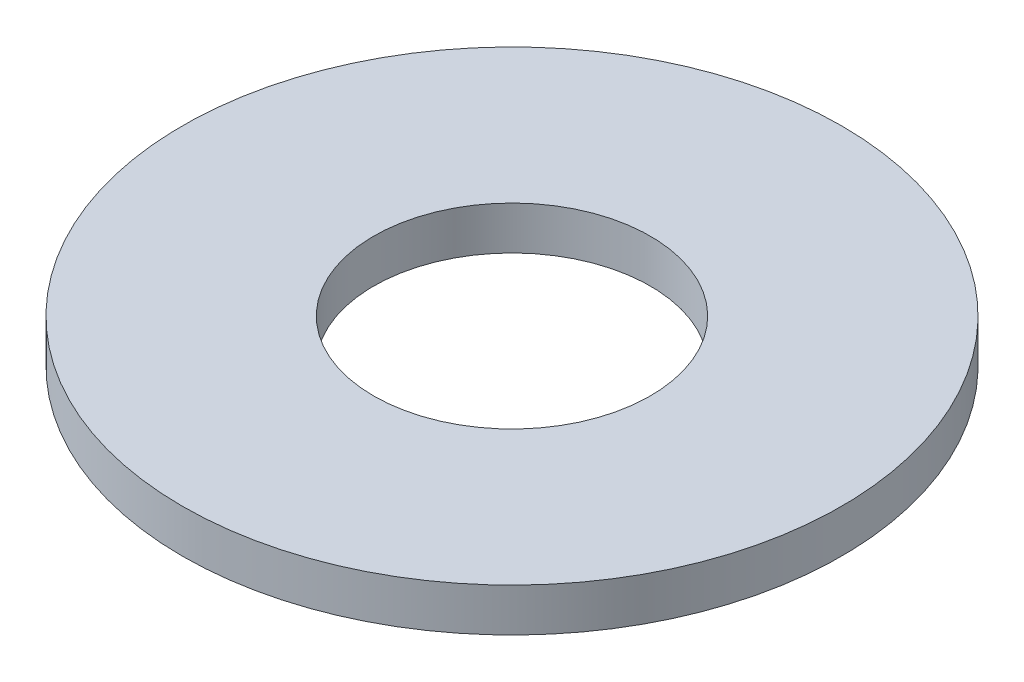
from build123d import *

# Parameters (mm, degrees)
SKETCH1_R           = 38.1
BOSS_EXTRUDE1_DEPTH = 5
SKETCH2_R           = 16
CUT_EXTRUDE1_DEPTH  = 5


with BuildPart() as part:
    # Sketch1 → Boss-Extrude1 (new body)
    with BuildSketch(Plane(origin=(0, 0, 0), x_dir=(1, 0, 0), z_dir=(0, 1, 0))):
        with Locations(Location((0, 0, 0), (0, 0, 270))):
            Circle(SKETCH1_R)
    extrude(amount=BOSS_EXTRUDE1_DEPTH)

    # Sketch2 → Cut-Extrude1 (cut)
    with BuildSketch(Plane(origin=(0, 5, 0), x_dir=(1, 0, 0), z_dir=(0, 1, 0))):
        with Locations(Location((0, 0, 0), (0, 0, 270))):
            Circle(SKETCH2_R)
    extrude(amount=-CUT_EXTRUDE1_DEPTH, mode=Mode.SUBTRACT)


solid = part.part
